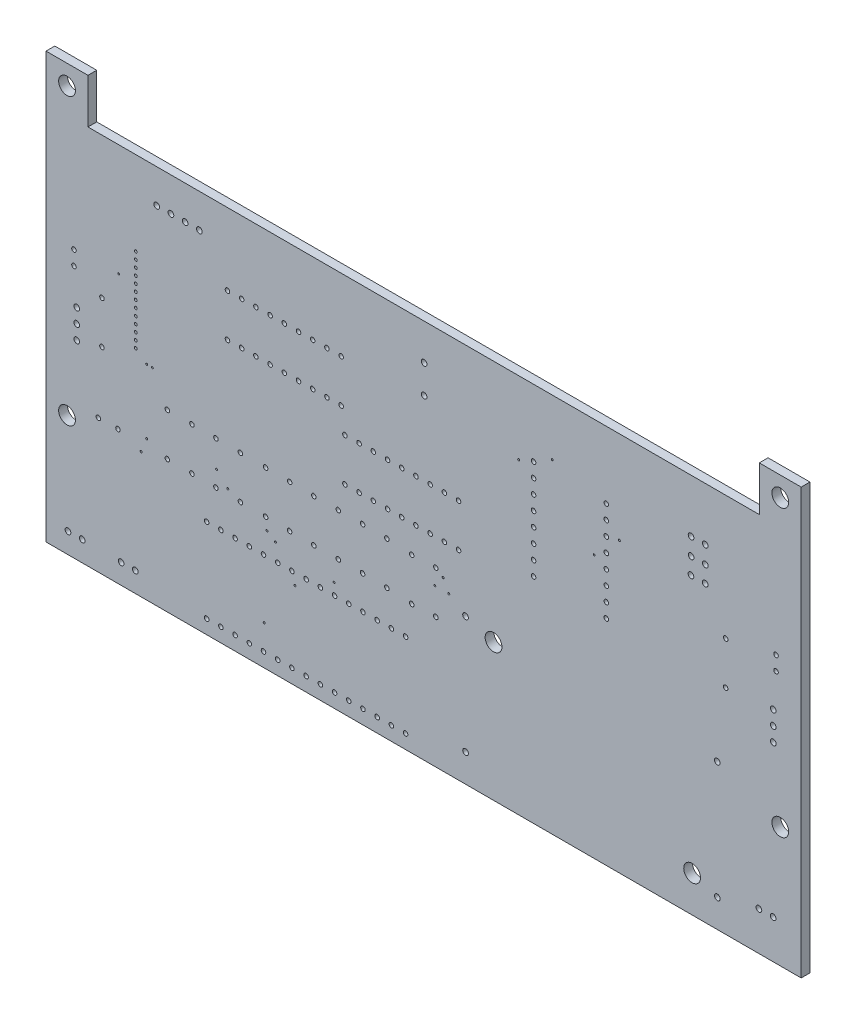
from build123d import *

# Parameters (mm, degrees)
ESQUISSE1_W             = 135
ESQUISSE1_H             = 76
ESQUISSE1_R             = 1.5
ESQUISSE1_R_2           = 0.508
ESQUISSE1_R_3           = 0.4065
ESQUISSE1_R_4           = 0.25
ESQUISSE1_R_5           = 0.175
ESQUISSE1_R_6           = 0.4
BOSS_EXTRU_1_DEPTH      = 1.57
ESQUISSE2_W             = 120
ESQUISSE2_H             = 8
ENL_V_MAT_EXTRU_1_DEPTH = 155.930516361


with BuildPart() as part:
    # Esquisse1 → Boss.-Extru.1 (new body)
    with BuildSketch(Plane.XY.offset(1.57)):
        with Locations((67.5, 38)):
            Rectangle(ESQUISSE1_W, ESQUISSE1_H)
        with Locations(Location((115.5, 6.5, 0), (0, 0, 180))):
            Circle(ESQUISSE1_R, mode=Mode.SUBTRACT)
        with Locations(Location((80, 24.5, 0), (0, 0, 180))):
            Circle(ESQUISSE1_R, mode=Mode.SUBTRACT)
        with Locations(Location((3.76, 72.5, 0), (0, 0, 180))):
            Circle(ESQUISSE1_R, mode=Mode.SUBTRACT)
        with Locations(Location((3.76, 21.5, 0), (0, 0, 180))):
            Circle(ESQUISSE1_R, mode=Mode.SUBTRACT)
        with Locations(Location((131.26, 21.5, 0), (0, 0, 180))):
            Circle(ESQUISSE1_R, mode=Mode.SUBTRACT)
        with Locations(Location((131.26, 72.5, 0), (0, 0, 180))):
            Circle(ESQUISSE1_R, mode=Mode.SUBTRACT)
        with Locations(Location((120, 26, 0), (0, 0, 180))):
            Circle(ESQUISSE1_R_2, mode=Mode.SUBTRACT)
        with Locations(Location((75, 26, 0), (0, 0, 180))):
            Circle(ESQUISSE1_R_2, mode=Mode.SUBTRACT)
        with Locations(Location((130.5, 45.23, 0), (0, 0, 180))):
            Circle(ESQUISSE1_R_3, mode=Mode.SUBTRACT)
        with Locations(Location((5, 45.23, 0), (0, 0, 180))):
            Circle(ESQUISSE1_R_3, mode=Mode.SUBTRACT)
        with Locations(Location((16.05, 38, 0), (0, 0, 180))):
            Circle(ESQUISSE1_R_4, mode=Mode.SUBTRACT)
        with Locations(Location((16.05, 40.5, 0), (0, 0, 180))):
            Circle(ESQUISSE1_R_4, mode=Mode.SUBTRACT)
        with Locations(Location((16.05, 43, 0), (0, 0, 180))):
            Circle(ESQUISSE1_R_4, mode=Mode.SUBTRACT)
        with Locations(Location((16.05, 45.5, 0), (0, 0, 180))):
            Circle(ESQUISSE1_R_4, mode=Mode.SUBTRACT)
        with Locations(Location((16.05, 48, 0), (0, 0, 180))):
            Circle(ESQUISSE1_R_4, mode=Mode.SUBTRACT)
        with Locations(Location((16.05, 50.5, 0), (0, 0, 180))):
            Circle(ESQUISSE1_R_4, mode=Mode.SUBTRACT)
        with Locations(Location((16.05, 53, 0), (0, 0, 180))):
            Circle(ESQUISSE1_R_4, mode=Mode.SUBTRACT)
        with Locations(Location((55.97, 43.26, 0), (0, 0, 180))):
            Circle(ESQUISSE1_R_3, mode=Mode.SUBTRACT)
        with Locations(Location((61.05, 43.26, 0), (0, 0, 180))):
            Circle(ESQUISSE1_R_3, mode=Mode.SUBTRACT)
        with Locations(Location((66.13, 43.26, 0), (0, 0, 180))):
            Circle(ESQUISSE1_R_3, mode=Mode.SUBTRACT)
        with Locations(Location((71.21, 43.26, 0), (0, 0, 180))):
            Circle(ESQUISSE1_R_3, mode=Mode.SUBTRACT)
        with Locations(Location((73.75, 35.64, 0), (0, 0, 180))):
            Circle(ESQUISSE1_R_3, mode=Mode.SUBTRACT)
        with Locations(Location((68.67, 35.64, 0), (0, 0, 180))):
            Circle(ESQUISSE1_R_3, mode=Mode.SUBTRACT)
        with Locations(Location((63.59, 35.64, 0), (0, 0, 180))):
            Circle(ESQUISSE1_R_3, mode=Mode.SUBTRACT)
        with Locations(Location((58.51, 35.64, 0), (0, 0, 180))):
            Circle(ESQUISSE1_R_3, mode=Mode.SUBTRACT)
        with Locations(Location((53.43, 35.64, 0), (0, 0, 180))):
            Circle(ESQUISSE1_R_3, mode=Mode.SUBTRACT)
        with Locations(Location((34.98, 55.13, 0), (0, 0, 180))):
            Circle(ESQUISSE1_R_3, mode=Mode.SUBTRACT)
        with Locations(Location((40.06, 55.13, 0), (0, 0, 180))):
            Circle(ESQUISSE1_R_3, mode=Mode.SUBTRACT)
        with Locations(Location((45.14, 55.13, 0), (0, 0, 180))):
            Circle(ESQUISSE1_R_3, mode=Mode.SUBTRACT)
        with Locations(Location((50.22, 55.13, 0), (0, 0, 180))):
            Circle(ESQUISSE1_R_3, mode=Mode.SUBTRACT)
        with Locations(Location((52.76, 47.51, 0), (0, 0, 180))):
            Circle(ESQUISSE1_R_3, mode=Mode.SUBTRACT)
        with Locations(Location((47.68, 47.51, 0), (0, 0, 180))):
            Circle(ESQUISSE1_R_3, mode=Mode.SUBTRACT)
        with Locations(Location((42.6, 47.51, 0), (0, 0, 180))):
            Circle(ESQUISSE1_R_3, mode=Mode.SUBTRACT)
        with Locations(Location((37.52, 47.51, 0), (0, 0, 180))):
            Circle(ESQUISSE1_R_3, mode=Mode.SUBTRACT)
        with Locations(Location((32.44, 47.51, 0), (0, 0, 180))):
            Circle(ESQUISSE1_R_3, mode=Mode.SUBTRACT)
        with Locations(Location((19.79, 61.96, 0), (0, 0, 180))):
            Circle(ESQUISSE1_R_2, mode=Mode.SUBTRACT)
        with Locations(Location((24.87, 61.96, 0), (0, 0, 180))):
            Circle(ESQUISSE1_R_2, mode=Mode.SUBTRACT)
        with Locations(Location((121.5, 45.81, 0), (0, 0, 180))):
            Circle(ESQUISSE1_R_3, mode=Mode.SUBTRACT)
        with Locations(Location((10, 42.81, 0), (0, 0, 180))):
            Circle(ESQUISSE1_R_3, mode=Mode.SUBTRACT)
        with Locations(Location((56.59, 23.44, 0), (0, 0, 180))):
            Circle(ESQUISSE1_R_3, mode=Mode.SUBTRACT)
        with Locations(Location((52.25, 23.44, 0), (0, 0, 180))):
            Circle(ESQUISSE1_R_3, mode=Mode.SUBTRACT)
        with Locations(Location((47.87, 23.42, 0), (0, 0, 180))):
            Circle(ESQUISSE1_R_3, mode=Mode.SUBTRACT)
        with Locations(Location((43.55, 23.47, 0), (0, 0, 180))):
            Circle(ESQUISSE1_R_3, mode=Mode.SUBTRACT)
        with Locations(Location((39.26, 23.54, 0), (0, 0, 180))):
            Circle(ESQUISSE1_R_3, mode=Mode.SUBTRACT)
        with Locations(Location((34.75, 23.56, 0), (0, 0, 180))):
            Circle(ESQUISSE1_R_3, mode=Mode.SUBTRACT)
        with Locations(Location((30.38, 23.62, 0), (0, 0, 180))):
            Circle(ESQUISSE1_R_3, mode=Mode.SUBTRACT)
        with Locations(Location((26.09, 23.65, 0), (0, 0, 180))):
            Circle(ESQUISSE1_R_3, mode=Mode.SUBTRACT)
        with Locations(Location((69.68, 23.25, 0), (0, 0, 180))):
            Circle(ESQUISSE1_R_3, mode=Mode.SUBTRACT)
        with Locations(Location((65.37, 23.09, 0), (0, 0, 180))):
            Circle(ESQUISSE1_R_3, mode=Mode.SUBTRACT)
        with Locations(Location((60.93, 23.37, 0), (0, 0, 180))):
            Circle(ESQUISSE1_R_3, mode=Mode.SUBTRACT)
        with Locations(Location((39, 7, 0), (0, 0, 180))):
            Circle(ESQUISSE1_R_5, mode=Mode.SUBTRACT)
        with Locations(Location((130, 39.07, 0), (0, 0, 180))):
            Circle(ESQUISSE1_R_2, mode=Mode.SUBTRACT)
        with Locations(Location((130, 33.99, 0), (0, 0, 180))):
            Circle(ESQUISSE1_R_2, mode=Mode.SUBTRACT)
        with Locations(Location((5.49, 36.51, 0), (0, 0, 180))):
            Circle(ESQUISSE1_R_2, mode=Mode.SUBTRACT)
        with Locations(Location((12.86, 23.91, 0), (0, 0, 180))):
            Circle(ESQUISSE1_R_6, mode=Mode.SUBTRACT)
        with Locations(Location((67.59, 61.54, 0), (0, 0, 180))):
            Circle(ESQUISSE1_R_2, mode=Mode.SUBTRACT)
        with Locations(Location((28.72, 17.5, 0), (0, 0, 180))):
            Circle(ESQUISSE1_R_3, mode=Mode.SUBTRACT)
        with Locations(Location((33.8, 17.5, 0), (0, 0, 180))):
            Circle(ESQUISSE1_R_3, mode=Mode.SUBTRACT)
        with Locations(Location((38.88, 17.5, 0), (0, 0, 180))):
            Circle(ESQUISSE1_R_3, mode=Mode.SUBTRACT)
        with Locations(Location((43.96, 17.5, 0), (0, 0, 180))):
            Circle(ESQUISSE1_R_3, mode=Mode.SUBTRACT)
        with Locations(Location((49.04, 17.5, 0), (0, 0, 180))):
            Circle(ESQUISSE1_R_3, mode=Mode.SUBTRACT)
        with Locations(Location((54.12, 17.5, 0), (0, 0, 180))):
            Circle(ESQUISSE1_R_3, mode=Mode.SUBTRACT)
        with Locations(Location((59.2, 17.5, 0), (0, 0, 180))):
            Circle(ESQUISSE1_R_3, mode=Mode.SUBTRACT)
        with Locations(Location((64.28, 17.5, 0), (0, 0, 180))):
            Circle(ESQUISSE1_R_3, mode=Mode.SUBTRACT)
        with Locations(Location((61.74, 2.5, 0), (0, 0, 180))):
            Circle(ESQUISSE1_R_3, mode=Mode.SUBTRACT)
        with Locations(Location((56.66, 2.5, 0), (0, 0, 180))):
            Circle(ESQUISSE1_R_3, mode=Mode.SUBTRACT)
        with Locations(Location((51.58, 2.5, 0), (0, 0, 180))):
            Circle(ESQUISSE1_R_3, mode=Mode.SUBTRACT)
        with Locations(Location((46.5, 2.5, 0), (0, 0, 180))):
            Circle(ESQUISSE1_R_3, mode=Mode.SUBTRACT)
        with Locations(Location((41.42, 2.5, 0), (0, 0, 180))):
            Circle(ESQUISSE1_R_3, mode=Mode.SUBTRACT)
        with Locations(Location((36.34, 2.5, 0), (0, 0, 180))):
            Circle(ESQUISSE1_R_3, mode=Mode.SUBTRACT)
        with Locations(Location((31.26, 2.5, 0), (0, 0, 180))):
            Circle(ESQUISSE1_R_3, mode=Mode.SUBTRACT)
        with Locations(Location((87.16, 38.24, 0), (0, 0, 180))):
            Circle(ESQUISSE1_R_3, mode=Mode.SUBTRACT)
        with Locations(Location((87.16, 43.32, 0), (0, 0, 180))):
            Circle(ESQUISSE1_R_3, mode=Mode.SUBTRACT)
        with Locations(Location((87.16, 48.4, 0), (0, 0, 180))):
            Circle(ESQUISSE1_R_3, mode=Mode.SUBTRACT)
        with Locations(Location((87.16, 53.48, 0), (0, 0, 180))):
            Circle(ESQUISSE1_R_3, mode=Mode.SUBTRACT)
        with Locations(Location((100.16, 56.02, 0), (0, 0, 180))):
            Circle(ESQUISSE1_R_3, mode=Mode.SUBTRACT)
        with Locations(Location((100.16, 50.94, 0), (0, 0, 180))):
            Circle(ESQUISSE1_R_3, mode=Mode.SUBTRACT)
        with Locations(Location((100.16, 45.86, 0), (0, 0, 180))):
            Circle(ESQUISSE1_R_3, mode=Mode.SUBTRACT)
        with Locations(Location((100.16, 40.78, 0), (0, 0, 180))):
            Circle(ESQUISSE1_R_3, mode=Mode.SUBTRACT)
        with Locations(Location((13.43, 3.57, 0), (0, 0, 180))):
            Circle(ESQUISSE1_R_2, mode=Mode.SUBTRACT)
        with Locations(Location((3.93, 3.64, 0), (0, 0, 180))):
            Circle(ESQUISSE1_R_2, mode=Mode.SUBTRACT)
        with Locations(Location((117.85, 58.52, 0), (0, 0, 180))):
            Circle(ESQUISSE1_R_2, mode=Mode.SUBTRACT)
        with Locations(Location((117.86, 55.46, 0), (0, 0, 180))):
            Circle(ESQUISSE1_R_2, mode=Mode.SUBTRACT)
        with Locations(Location((117.83, 52.49, 0), (0, 0, 180))):
            Circle(ESQUISSE1_R_2, mode=Mode.SUBTRACT)
        with Locations(Location((129.98, 6.93, 0), (0, 0, 180))):
            Circle(ESQUISSE1_R_2, mode=Mode.SUBTRACT)
        with Locations(Location((72, 28, 0), (0, 0, 180))):
            Circle(ESQUISSE1_R_5, mode=Mode.SUBTRACT)
        with Locations(Location((19, 36.5, 0), (0, 0, 180))):
            Circle(ESQUISSE1_R_5, mode=Mode.SUBTRACT)
        with Locations(Location((51.5, 19.5, 0), (0, 0, 180))):
            Circle(ESQUISSE1_R_5, mode=Mode.SUBTRACT)
        with Locations(Location((39.5, 21.5, 0), (0, 0, 180))):
            Circle(ESQUISSE1_R_5, mode=Mode.SUBTRACT)
        with Locations(Location((41, 20.5, 0), (0, 0, 180))):
            Circle(ESQUISSE1_R_5, mode=Mode.SUBTRACT)
        with Locations(Location((30.5, 26.5, 0), (0, 0, 180))):
            Circle(ESQUISSE1_R_5, mode=Mode.SUBTRACT)
        with Locations(Location((32.5, 24.5, 0), (0, 0, 180))):
            Circle(ESQUISSE1_R_5, mode=Mode.SUBTRACT)
        with Locations(Location((44.5, 15.5, 0), (0, 0, 180))):
            Circle(ESQUISSE1_R_5, mode=Mode.SUBTRACT)
        with Locations(Location((69.5, 28, 0), (0, 0, 180))):
            Circle(ESQUISSE1_R_5, mode=Mode.SUBTRACT)
        with Locations(Location((102.5, 51.5, 0), (0, 0, 180))):
            Circle(ESQUISSE1_R_5, mode=Mode.SUBTRACT)
        with Locations(Location((71, 30, 0), (0, 0, 180))):
            Circle(ESQUISSE1_R_5, mode=Mode.SUBTRACT)
        with Locations(Location((98, 47, 0), (0, 0, 180))):
            Circle(ESQUISSE1_R_5, mode=Mode.SUBTRACT)
        with Locations(Location((17, 22.5, 0), (0, 0, 180))):
            Circle(ESQUISSE1_R_5, mode=Mode.SUBTRACT)
        with Locations(Location((18, 25, 0), (0, 0, 180))):
            Circle(ESQUISSE1_R_5, mode=Mode.SUBTRACT)
        with Locations(Location((84.5, 55, 0), (0, 0, 180))):
            Circle(ESQUISSE1_R_5, mode=Mode.SUBTRACT)
        with Locations(Location((90.5, 58, 0), (0, 0, 180))):
            Circle(ESQUISSE1_R_5, mode=Mode.SUBTRACT)
        with Locations(Location((13, 48, 0), (0, 0, 180))):
            Circle(ESQUISSE1_R_5, mode=Mode.SUBTRACT)
        with Locations(Location((18, 36.5, 0), (0, 0, 180))):
            Circle(ESQUISSE1_R_5, mode=Mode.SUBTRACT)
        with Locations(Location((127.44, 6.93, 0), (0, 0, 180))):
            Circle(ESQUISSE1_R_2, mode=Mode.SUBTRACT)
        with Locations(Location((115.29, 52.49, 0), (0, 0, 180))):
            Circle(ESQUISSE1_R_2, mode=Mode.SUBTRACT)
        with Locations(Location((115.32, 55.46, 0), (0, 0, 180))):
            Circle(ESQUISSE1_R_2, mode=Mode.SUBTRACT)
        with Locations(Location((115.31, 58.52, 0), (0, 0, 180))):
            Circle(ESQUISSE1_R_2, mode=Mode.SUBTRACT)
        with Locations(Location((6.47, 3.64, 0), (0, 0, 180))):
            Circle(ESQUISSE1_R_2, mode=Mode.SUBTRACT)
        with Locations(Location((15.97, 3.57, 0), (0, 0, 180))):
            Circle(ESQUISSE1_R_2, mode=Mode.SUBTRACT)
        with Locations(Location((100.16, 38.24, 0), (0, 0, 180))):
            Circle(ESQUISSE1_R_3, mode=Mode.SUBTRACT)
        with Locations(Location((100.16, 43.32, 0), (0, 0, 180))):
            Circle(ESQUISSE1_R_3, mode=Mode.SUBTRACT)
        with Locations(Location((100.16, 48.4, 0), (0, 0, 180))):
            Circle(ESQUISSE1_R_3, mode=Mode.SUBTRACT)
        with Locations(Location((100.16, 53.48, 0), (0, 0, 180))):
            Circle(ESQUISSE1_R_3, mode=Mode.SUBTRACT)
        with Locations(Location((87.16, 56.02, 0), (0, 0, 180))):
            Circle(ESQUISSE1_R_3, mode=Mode.SUBTRACT)
        with Locations(Location((87.16, 50.94, 0), (0, 0, 180))):
            Circle(ESQUISSE1_R_3, mode=Mode.SUBTRACT)
        with Locations(Location((87.16, 45.86, 0), (0, 0, 180))):
            Circle(ESQUISSE1_R_3, mode=Mode.SUBTRACT)
        with Locations(Location((87.16, 40.78, 0), (0, 0, 180))):
            Circle(ESQUISSE1_R_3, mode=Mode.SUBTRACT)
        with Locations(Location((28.72, 2.5, 0), (0, 0, 180))):
            Circle(ESQUISSE1_R_3, mode=Mode.SUBTRACT)
        with Locations(Location((33.8, 2.5, 0), (0, 0, 180))):
            Circle(ESQUISSE1_R_3, mode=Mode.SUBTRACT)
        with Locations(Location((38.88, 2.5, 0), (0, 0, 180))):
            Circle(ESQUISSE1_R_3, mode=Mode.SUBTRACT)
        with Locations(Location((43.96, 2.5, 0), (0, 0, 180))):
            Circle(ESQUISSE1_R_3, mode=Mode.SUBTRACT)
        with Locations(Location((49.04, 2.5, 0), (0, 0, 180))):
            Circle(ESQUISSE1_R_3, mode=Mode.SUBTRACT)
        with Locations(Location((54.12, 2.5, 0), (0, 0, 180))):
            Circle(ESQUISSE1_R_3, mode=Mode.SUBTRACT)
        with Locations(Location((59.2, 2.5, 0), (0, 0, 180))):
            Circle(ESQUISSE1_R_3, mode=Mode.SUBTRACT)
        with Locations(Location((64.28, 2.5, 0), (0, 0, 180))):
            Circle(ESQUISSE1_R_3, mode=Mode.SUBTRACT)
        with Locations(Location((61.74, 17.5, 0), (0, 0, 180))):
            Circle(ESQUISSE1_R_3, mode=Mode.SUBTRACT)
        with Locations(Location((56.66, 17.5, 0), (0, 0, 180))):
            Circle(ESQUISSE1_R_3, mode=Mode.SUBTRACT)
        with Locations(Location((51.58, 17.5, 0), (0, 0, 180))):
            Circle(ESQUISSE1_R_3, mode=Mode.SUBTRACT)
        with Locations(Location((46.5, 17.5, 0), (0, 0, 180))):
            Circle(ESQUISSE1_R_3, mode=Mode.SUBTRACT)
        with Locations(Location((41.42, 17.5, 0), (0, 0, 180))):
            Circle(ESQUISSE1_R_3, mode=Mode.SUBTRACT)
        with Locations(Location((36.34, 17.5, 0), (0, 0, 180))):
            Circle(ESQUISSE1_R_3, mode=Mode.SUBTRACT)
        with Locations(Location((31.26, 17.5, 0), (0, 0, 180))):
            Circle(ESQUISSE1_R_3, mode=Mode.SUBTRACT)
        with Locations(Location((67.59, 56.46, 0), (0, 0, 180))):
            Circle(ESQUISSE1_R_2, mode=Mode.SUBTRACT)
        with Locations(Location((9.36, 23.91, 0), (0, 0, 180))):
            Circle(ESQUISSE1_R_6, mode=Mode.SUBTRACT)
        with Locations(Location((5.49, 39.05, 0), (0, 0, 180))):
            Circle(ESQUISSE1_R_2, mode=Mode.SUBTRACT)
        with Locations(Location((5.49, 33.97, 0), (0, 0, 180))):
            Circle(ESQUISSE1_R_2, mode=Mode.SUBTRACT)
        with Locations(Location((130, 36.53, 0), (0, 0, 180))):
            Circle(ESQUISSE1_R_2, mode=Mode.SUBTRACT)
        with Locations(Location((21.69, 23.68, 0), (0, 0, 180))):
            Circle(ESQUISSE1_R_3, mode=Mode.SUBTRACT)
        with Locations(Location((21.69, 31.3, 0), (0, 0, 180))):
            Circle(ESQUISSE1_R_3, mode=Mode.SUBTRACT)
        with Locations(Location((60.93, 30.99, 0), (0, 0, 180))):
            Circle(ESQUISSE1_R_3, mode=Mode.SUBTRACT)
        with Locations(Location((65.37, 30.71, 0), (0, 0, 180))):
            Circle(ESQUISSE1_R_3, mode=Mode.SUBTRACT)
        with Locations(Location((69.68, 30.87, 0), (0, 0, 180))):
            Circle(ESQUISSE1_R_3, mode=Mode.SUBTRACT)
        with Locations(Location((26.09, 31.27, 0), (0, 0, 180))):
            Circle(ESQUISSE1_R_3, mode=Mode.SUBTRACT)
        with Locations(Location((30.38, 31.24, 0), (0, 0, 180))):
            Circle(ESQUISSE1_R_3, mode=Mode.SUBTRACT)
        with Locations(Location((34.75, 31.18, 0), (0, 0, 180))):
            Circle(ESQUISSE1_R_3, mode=Mode.SUBTRACT)
        with Locations(Location((39.26, 31.16, 0), (0, 0, 180))):
            Circle(ESQUISSE1_R_3, mode=Mode.SUBTRACT)
        with Locations(Location((43.55, 31.09, 0), (0, 0, 180))):
            Circle(ESQUISSE1_R_3, mode=Mode.SUBTRACT)
        with Locations(Location((47.87, 31.04, 0), (0, 0, 180))):
            Circle(ESQUISSE1_R_3, mode=Mode.SUBTRACT)
        with Locations(Location((52.25, 31.06, 0), (0, 0, 180))):
            Circle(ESQUISSE1_R_3, mode=Mode.SUBTRACT)
        with Locations(Location((56.59, 31.06, 0), (0, 0, 180))):
            Circle(ESQUISSE1_R_3, mode=Mode.SUBTRACT)
        with Locations(Location((10, 35.19, 0), (0, 0, 180))):
            Circle(ESQUISSE1_R_3, mode=Mode.SUBTRACT)
        with Locations(Location((121.5, 38.19, 0), (0, 0, 180))):
            Circle(ESQUISSE1_R_3, mode=Mode.SUBTRACT)
        with Locations(Location((22.33, 61.96, 0), (0, 0, 180))):
            Circle(ESQUISSE1_R_2, mode=Mode.SUBTRACT)
        with Locations(Location((27.41, 61.96, 0), (0, 0, 180))):
            Circle(ESQUISSE1_R_2, mode=Mode.SUBTRACT)
        with Locations(Location((34.98, 47.51, 0), (0, 0, 180))):
            Circle(ESQUISSE1_R_3, mode=Mode.SUBTRACT)
        with Locations(Location((40.06, 47.51, 0), (0, 0, 180))):
            Circle(ESQUISSE1_R_3, mode=Mode.SUBTRACT)
        with Locations(Location((45.14, 47.51, 0), (0, 0, 180))):
            Circle(ESQUISSE1_R_3, mode=Mode.SUBTRACT)
        with Locations(Location((50.22, 47.51, 0), (0, 0, 180))):
            Circle(ESQUISSE1_R_3, mode=Mode.SUBTRACT)
        with Locations(Location((52.76, 55.13, 0), (0, 0, 180))):
            Circle(ESQUISSE1_R_3, mode=Mode.SUBTRACT)
        with Locations(Location((47.68, 55.13, 0), (0, 0, 180))):
            Circle(ESQUISSE1_R_3, mode=Mode.SUBTRACT)
        with Locations(Location((42.6, 55.13, 0), (0, 0, 180))):
            Circle(ESQUISSE1_R_3, mode=Mode.SUBTRACT)
        with Locations(Location((37.52, 55.13, 0), (0, 0, 180))):
            Circle(ESQUISSE1_R_3, mode=Mode.SUBTRACT)
        with Locations(Location((32.44, 55.13, 0), (0, 0, 180))):
            Circle(ESQUISSE1_R_3, mode=Mode.SUBTRACT)
        with Locations(Location((55.97, 35.64, 0), (0, 0, 180))):
            Circle(ESQUISSE1_R_3, mode=Mode.SUBTRACT)
        with Locations(Location((61.05, 35.64, 0), (0, 0, 180))):
            Circle(ESQUISSE1_R_3, mode=Mode.SUBTRACT)
        with Locations(Location((66.13, 35.64, 0), (0, 0, 180))):
            Circle(ESQUISSE1_R_3, mode=Mode.SUBTRACT)
        with Locations(Location((71.21, 35.64, 0), (0, 0, 180))):
            Circle(ESQUISSE1_R_3, mode=Mode.SUBTRACT)
        with Locations(Location((73.75, 43.26, 0), (0, 0, 180))):
            Circle(ESQUISSE1_R_3, mode=Mode.SUBTRACT)
        with Locations(Location((68.67, 43.26, 0), (0, 0, 180))):
            Circle(ESQUISSE1_R_3, mode=Mode.SUBTRACT)
        with Locations(Location((63.59, 43.26, 0), (0, 0, 180))):
            Circle(ESQUISSE1_R_3, mode=Mode.SUBTRACT)
        with Locations(Location((58.51, 43.26, 0), (0, 0, 180))):
            Circle(ESQUISSE1_R_3, mode=Mode.SUBTRACT)
        with Locations(Location((53.43, 43.26, 0), (0, 0, 180))):
            Circle(ESQUISSE1_R_3, mode=Mode.SUBTRACT)
        with Locations(Location((16.05, 51.75, 0), (0, 0, 180))):
            Circle(ESQUISSE1_R_4, mode=Mode.SUBTRACT)
        with Locations(Location((16.05, 49.25, 0), (0, 0, 180))):
            Circle(ESQUISSE1_R_4, mode=Mode.SUBTRACT)
        with Locations(Location((16.05, 46.75, 0), (0, 0, 180))):
            Circle(ESQUISSE1_R_4, mode=Mode.SUBTRACT)
        with Locations(Location((16.05, 44.25, 0), (0, 0, 180))):
            Circle(ESQUISSE1_R_4, mode=Mode.SUBTRACT)
        with Locations(Location((16.05, 41.75, 0), (0, 0, 180))):
            Circle(ESQUISSE1_R_4, mode=Mode.SUBTRACT)
        with Locations(Location((16.05, 39.25, 0), (0, 0, 180))):
            Circle(ESQUISSE1_R_4, mode=Mode.SUBTRACT)
        with Locations(Location((5, 47.77, 0), (0, 0, 180))):
            Circle(ESQUISSE1_R_3, mode=Mode.SUBTRACT)
        with Locations(Location((130.5, 47.77, 0), (0, 0, 180))):
            Circle(ESQUISSE1_R_3, mode=Mode.SUBTRACT)
        with Locations(Location((75, 5, 0), (0, 0, 180))):
            Circle(ESQUISSE1_R_2, mode=Mode.SUBTRACT)
        with Locations(Location((120, 5, 0), (0, 0, 180))):
            Circle(ESQUISSE1_R_2, mode=Mode.SUBTRACT)
    extrude(amount=-BOSS_EXTRU_1_DEPTH)

    # Esquisse2 → Enlèv. mat.-Extru.1 (cut, through all)
    with BuildSketch(Plane.XY.offset(1.57)):
        with Locations((67.5, 72)):
            Rectangle(ESQUISSE2_W, ESQUISSE2_H)
    extrude(amount=-ENL_V_MAT_EXTRU_1_DEPTH, mode=Mode.SUBTRACT)


solid = part.part
